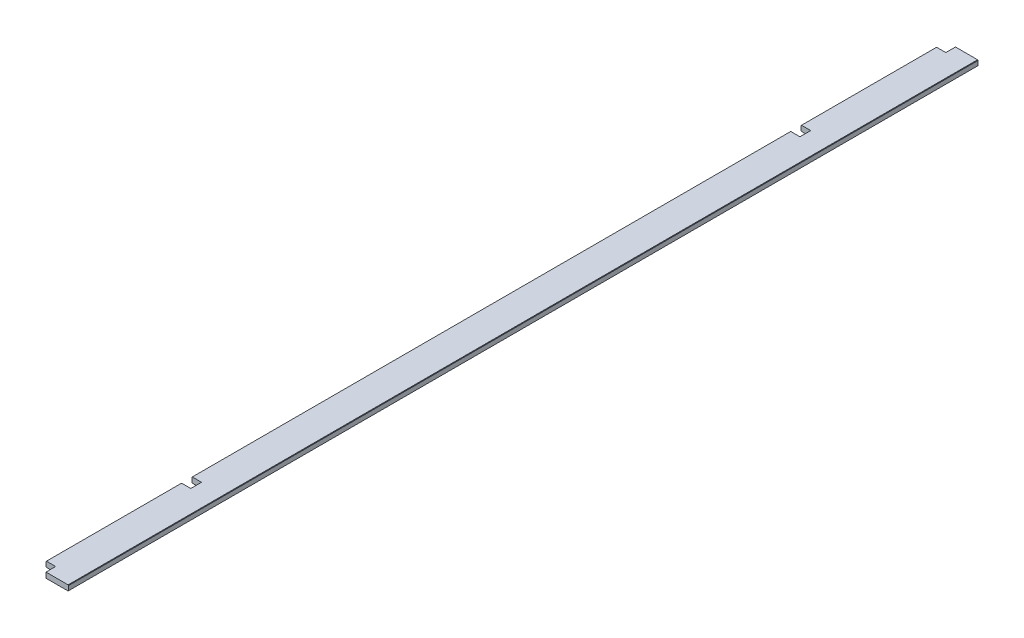
from build123d import *

# Parameters (mm, degrees)
EXTRUDE_1_DEPTH     = 4240
SKETCH_2_W          = 45
SKETCH_2_H          = 45
SKETCH_2_H_2        = 50
CUT_EXTRUDE_4_DEPTH = 4241.736964255


with BuildPart() as part:
    # Эскиз1 → Бобышка-Вытянуть1 (new body)
    with BuildSketch(Plane.XY):
        Polygon((-75, 10.5), (-73, 12.5), (73, 12.5), (75, 10.5), (75, -10.5), (73, -12.5), (-73, -12.5), (-75, -10.5), align=None)
    extrude(amount=EXTRUDE_1_DEPTH)

    # Эскиз2 → Вырез-Вытянуть4 (cut, through all)
    with BuildSketch(Plane(origin=(0, 12.5, 0), x_dir=(1, 0, 0), z_dir=(0, 1, 0))):
        with Locations((-52.5, -22.5)):
            Rectangle(SKETCH_2_W, SKETCH_2_H)
        with Locations((-52.5, -4217.5)):
            Rectangle(SKETCH_2_W, SKETCH_2_H)
        with Locations((-52.5, -700)):
            Rectangle(SKETCH_2_W, SKETCH_2_H_2)
        with Locations((-52.5, -3540)):
            Rectangle(SKETCH_2_W, SKETCH_2_H_2)
    extrude(amount=-CUT_EXTRUDE_4_DEPTH, mode=Mode.SUBTRACT)


solid = part.part
